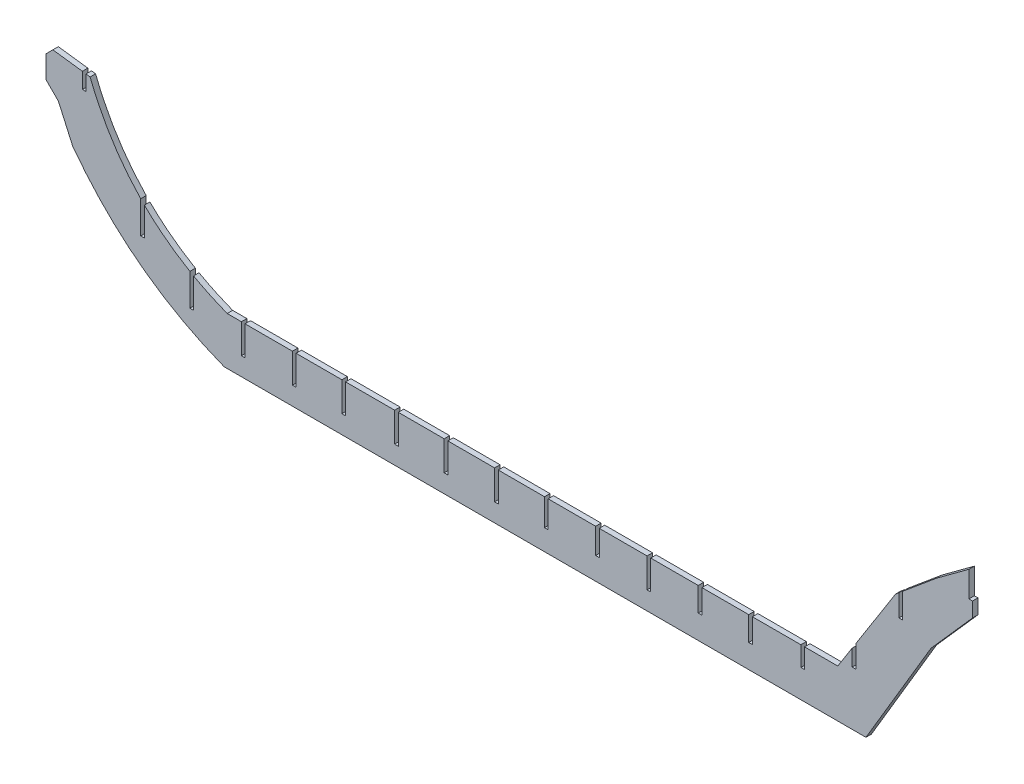
from build123d import *

# Parameters (mm, degrees)
BOSS_EXTRU_2_DEPTH      = 9
ENL_V_MAT_EXTRU_2_DEPTH = 9
ESQUISSE5_W             = 6
ESQUISSE5_H             = 25.84965
ENL_V_MAT_EXTRU_3_DEPTH = 10


with BuildPart() as part:
    # Esquisse2 → Boss.-Extru.2 (new body)
    with BuildSketch(Plane.XY):
        with BuildLine():
            Line((0, 0), (-1055.446290734, 0))
            add(Edge.make_bspline(
                [(-1055.446290734, 0), (-1207.572733387, 59.072106031), (-1304.579199027, 189.593529265)],
                knots=[0, 0, 0, 1, 1, 1], degree=2))
            Line((-1304.579199027, 189.593529265), (-1328.155601237, 242.090877604))
            Line((-1328.155601237, 242.090877604), (-1348.517039509, 262.446992266))
            Line((-1348.517039509, 262.446992266), (-1348.517039509, 299.331021292))
            Line((-1348.517039509, 299.331021292), (-1337.24264668, 310.608362644))
            Line((-1337.24264668, 310.608362644), (-1275.966827179, 302.644588826))
            add(Edge.make_bspline(
                [(-1275.966827179, 302.644588826), (-1212.760641583, 141.531535954), (-1050.525159664, 78.394553502)],
                knots=[0, 0, 0, 1, 1, 1], degree=2))
            Line((-1050.525159664, 78.394553502), (-46.371074076, 78.394553502))
            Line((-46.371074076, 78.394553502), (48.76008987, 228.44376205))
            Line((48.76008987, 228.44376205), (115.880348206, 284.547364773))
            Line((115.880348206, 284.547364773), (175.286334456, 328.432610938))
            Line((175.286334456, 328.432610938), (175.286334456, 257.621549377))
            Line((175.286334456, 257.621549377), (107.11594567, 180.577636332))
            Line((107.11594567, 180.577636332), (0, 0))
        make_face()
    extrude(amount=BOSS_EXTRU_2_DEPTH)

    # Esquisse4 → Enlèv. mat.-Extru.2 (cut)
    with BuildSketch(Plane.XY.offset(9)):
        Polygon((-1192.710056644, 217.724215408), (-1192.710056644, 117.812636738), (-1186.710056644, 117.812636738), (-1186.710056644, 209.090265158), (-1144.70133954, 205.492785887), (-1111.824911273, 179.590935136), (-1111.824911273, 55.314515649), (-1105.824911273, 55.314515649), (-1105.824911273, 174.913937406), (-1058.771084869, 188.659470271), (-1027.191161845, 161.497477767), (-1027.191161845, 30), (-1021.191161845, 30), (-1021.191161845, 167.225098507), (-976.159938867, 174.429619005), (-943.229008237, 161.127659365), (-943.229008237, 30), (-937.229008237, 30), (-937.229008237, 164.093815562), (-899.191490776, 172.001101596), (-861.857811784, 160.098627493), (-861.857811784, 30), (-855.857811784, 30), (-855.857811784, 196.236545153), (-815.986169177, 204.901610664), (-775.188433973, 184.176190605), (-775.188433973, 30), (-769.188433973, 30), (-769.188433973, 176.450577912), (-732.223715867, 183.004336583), (-693.639593808, 163.215620457), (-693.639593808, 30), (-687.639593808, 30), (-687.639593808, 172.485228345), (-653.152535866, 182.871939208), (-610.716601792, 161.453305285), (-610.716601792, 30), (-604.716601792, 30), (-604.716601792, 256.125318922), (-551.321272632, 268.910222611), (-528.666744333, 255.862211449), (-528.666744333, 34.3), (-522.666744333, 34.3), (-522.666744333, 255.102102604), (-476.392141731, 269.107524931), (-444.607914754, 258.656296952), (-444.607914754, 36.7), (-438.607914754, 36.7), (-438.607914754, 253.443093933), (-391.056155042, 266.894918017), (-360.02126631, 254.206439852), (-360.02126631, 30), (-354.02126631, 30), (-354.02126631, 250.104032237), (-303.804875297, 262.547483763), (-275.81856885, 247.243298089), (-275.81856885, 39.1), (-269.81856885, 39.1), (-269.81856885, 230.071554094), (-217.437093626, 257.378680484), (-192.806508582, 246.762372601), (-192.806508582, 38.7), (-186.806508582, 38.7), (-186.806508582, 245.622867868), (-134.999273909, 264.79720393), (-106.993498927, 255.334085011), (-106.993498927, 46.1), (-100.993498927, 46.1), (-100.993498927, 258.655280604), (-22.735685337, 264.839286488), (-22.735685337, 88.7), (-16.735685337, 88.7), (-16.735685337, 231.395876397), (-1.733463181, 266.202092714), (54.176868866, 313.052154508), (54.176868866, 197.147050424), (60.176868866, 197.147050424), (60.176868866, 330.337520125), (-1075.947973634, 334.662873451), align=None)
    extrude(amount=-ENL_V_MAT_EXTRU_2_DEPTH, mode=Mode.SUBTRACT)

    # Esquisse5 → Enlèv. mat.-Extru.3 (cut)
    with BuildSketch(Plane.XY.offset(9)):
        Polygon((169.286334456, 324.000204482), (169.286334456, 281.800204482), (175.286334456, 281.800204482), (202.680394495, 285.052171219), (208.588297758, 339.079823363), (181.275473189, 338.718158681), align=None)
        with Locations((-1285.723549311, 291.377704112)):
            Rectangle(ESQUISSE5_W, ESQUISSE5_H)
    extrude(amount=-ENL_V_MAT_EXTRU_3_DEPTH, mode=Mode.SUBTRACT)


solid = part.part
